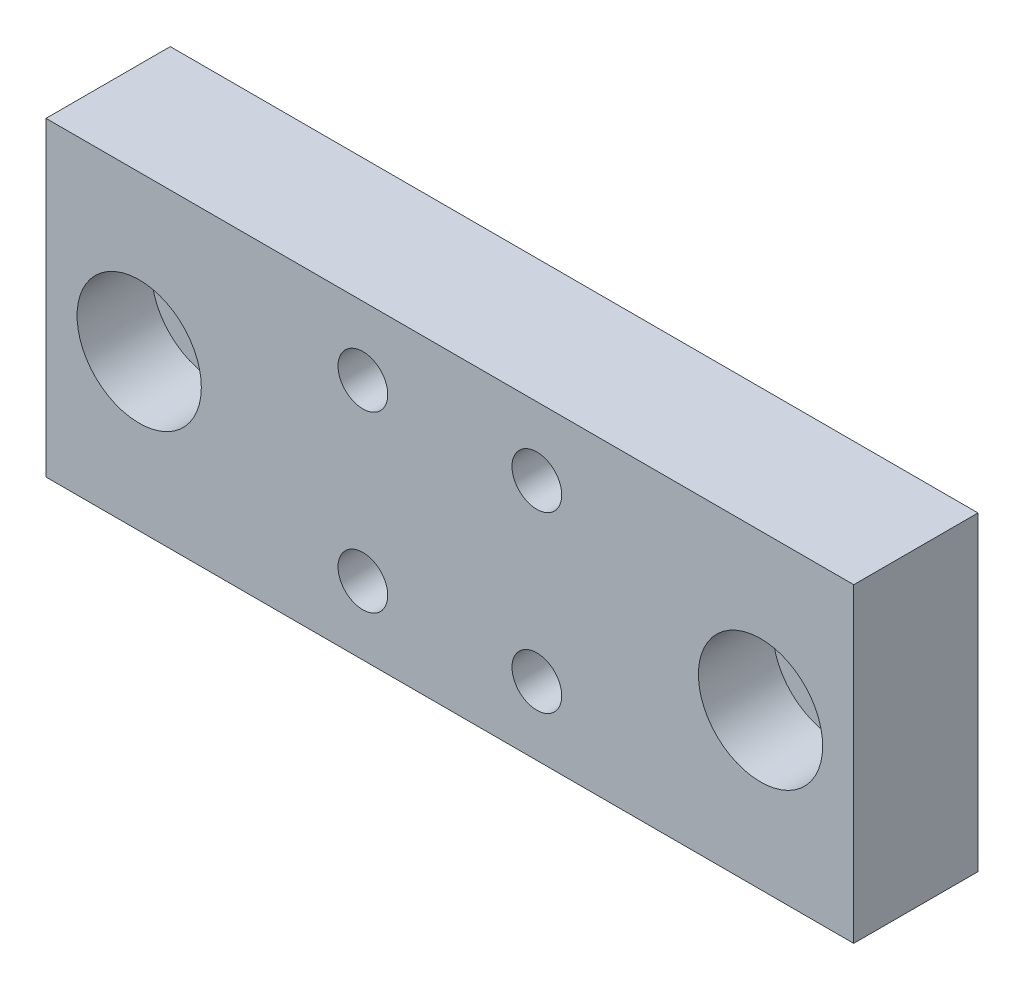
from build123d import *

# Parameters (mm, degrees)
SKETCH1_W           = 65
SKETCH1_H           = 25
BOSS_EXTRUDE1_DEPTH = 10
SKETCH3_R           = 2
CUT_EXTRUDE1_DEPTH  = 10
SKETCH5_R           = 4.1
CUT_EXTRUDE2_DEPTH  = 3.7
SKETCH12_R          = 3
CUT_EXTRUDE3_DEPTH  = 24.2
SKETCH13_R          = 5
CUT_EXTRUDE4_DEPTH  = 6


with BuildPart() as part:
    # Sketch1 → Boss-Extrude1 (new body)
    with BuildSketch(Plane.XY):
        with Locations((-15.021367521, 0)):
            Rectangle(SKETCH1_W, SKETCH1_H)
    extrude(amount=BOSS_EXTRUDE1_DEPTH)

    # Sketch3 → Cut-Extrude1 (cut)
    with BuildSketch(Plane(origin=(0, 0, 0), x_dir=(-1, 0, 0), z_dir=(0, 0, -1))):
        with Locations((22.021367521, -7)):
            Circle(SKETCH3_R)
        with Locations((8.021367521, -7)):
            Circle(SKETCH3_R)
        with Locations((8.021367521, 7)):
            Circle(SKETCH3_R)
        with Locations((22.021367521, 7)):
            Circle(SKETCH3_R)
    extrude(amount=-CUT_EXTRUDE1_DEPTH, mode=Mode.SUBTRACT)

    # Sketch5 → Cut-Extrude2 (cut)
    with BuildSketch(Plane(origin=(0, 0, 0), x_dir=(-1, 0, 0), z_dir=(0, 0, -1))):
        with Locations((22.021367521, -7)):
            Circle(SKETCH5_R)
        with Locations((8.021367521, -7)):
            Circle(SKETCH5_R)
        with Locations((8.021367521, 7)):
            Circle(SKETCH5_R)
        with Locations((22.021367521, 7)):
            Circle(SKETCH5_R)
    extrude(amount=-CUT_EXTRUDE2_DEPTH, mode=Mode.SUBTRACT)

    # Sketch12 → Cut-Extrude3 (cut)
    with BuildSketch(Plane.XY.offset(10)):
        with Locations((-40.021367521, 0)):
            Circle(SKETCH12_R)
        with Locations((9.978632479, 0)):
            Circle(SKETCH12_R)
    extrude(amount=-CUT_EXTRUDE3_DEPTH, mode=Mode.SUBTRACT)

    # Sketch13 → Cut-Extrude4 (cut)
    with BuildSketch(Plane.XY.offset(10)):
        with Locations((-40.021367521, 0)):
            Circle(SKETCH13_R)
        with Locations((9.978632479, 0)):
            Circle(SKETCH13_R)
    extrude(amount=-CUT_EXTRUDE4_DEPTH, mode=Mode.SUBTRACT)


solid = part.part
